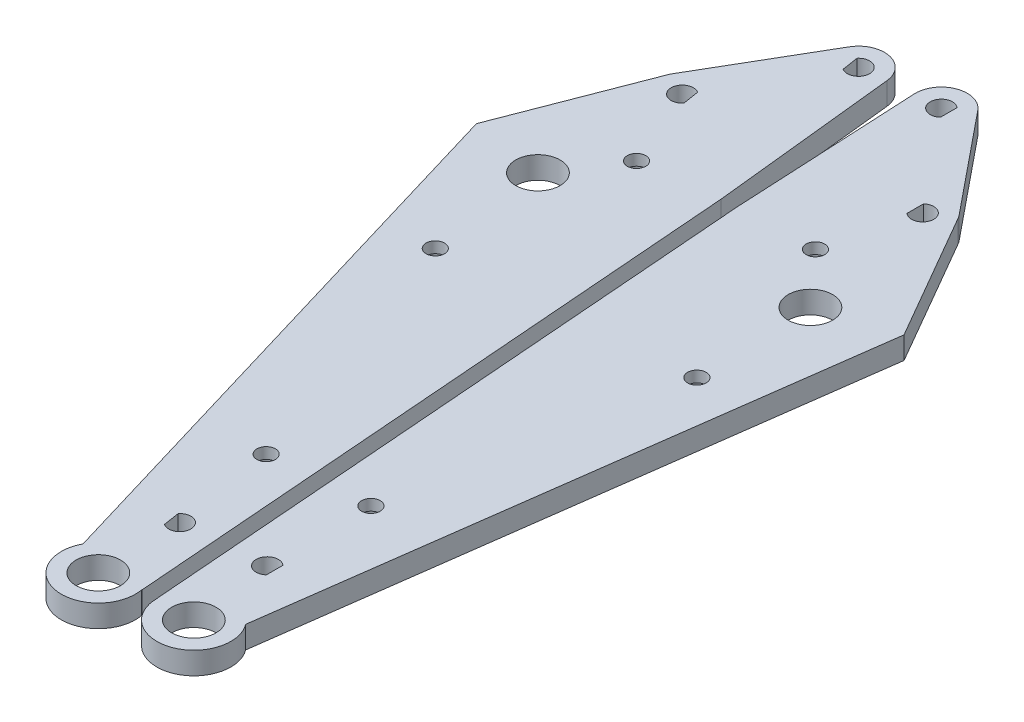
from build123d import *

# Parameters (mm, degrees)
SKETCH_2_R          = 3
EXTRUDE_1_DEPTH     = 3
SKETCH_3_R          = 3.5
EXTRUDE_2_DEPTH     = 3
SKETCH_4_R          = 3.5
EXTRUDE_3_DEPTH     = 3
CUT_EXTRUDE_1_DEPTH = 107.618473768
CUT_EXTRUDE_2_DEPTH = 107.618473768
EXTRUDE_4_DEPTH     = 3
SKETCH_6_R          = 1.25
CUT_EXTRUDE_3_DEPTH = 107.618473768
SKETCH_6_3_R        = 2
SKETCH_6_3_R_2      = 1.25
CUT_EXTRUDE_4_DEPTH = 1.5


with BuildPart() as part:
    # 草图2 → 凸台-拉伸1 (new body)
    with BuildSketch(Plane(origin=(0, 0, 0), x_dir=(1, 0, 0), z_dir=(0, 1, 0))):
        with BuildLine():
            Line((-8, 0), (-15.238247957, -15.382059892))
            Line((-15.238247957, -15.382059892), (-8.643699882, -100.125861646))
            Line((-8.643699882, -100.125861646), (-8.61301011, -100.126871188))
            ThreePointArc((-8.61301011, -100.126871188), (-3.780099648, -105.28855468), (1.381583844, -100.455644218))
            Line((1.381583844, -100.455644218), (1.399355455, -100.456228817))
            Line((1.399355455, -100.456228817), (10.979274058, -19.016660498))
            Line((10.979274058, -19.016660498), (1.010362938, -1.749999943))
            ThreePointArc((1.010362938, -1.749999943), (-0.270725971, -0.46891107), (-2.020725942, 0))
            Line((-2.020725942, 0), (-8, 0))
        make_face()
        with Locations(Location((-3.615713133, -100.291257703, 0), (0, 0, 270))):
            Circle(SKETCH_2_R, mode=Mode.SUBTRACT)
        with BuildLine():
            ThreePointArc((-3.020725942, -2.381966011), (-0.520725942, -3.5), (-3.020725942, -4.618033989))
            Line((-3.020725942, -4.618033989), (-3.020725942, -2.381966011))
        make_face(mode=Mode.SUBTRACT)
        with Locations(Location((1.451061426, -22.124978573, 0), (0, 0, 270))):
            Circle(SKETCH_2_R, mode=Mode.SUBTRACT)
    extrude(amount=EXTRUDE_1_DEPTH)

    # 草图4 → 凸台-拉伸3 (add)
    with BuildSketch(Plane.XZ):
        with Locations((-5, 89)):
            Circle(SKETCH_4_R)
    extrude(amount=-EXTRUDE_3_DEPTH)

    # 草图4<3> → 切除-拉伸1 (cut, through all)
    with BuildSketch(Plane.XZ):
        with BuildLine():
            ThreePointArc((-3.5, 89), (-3.60795306, 89.55875336), (-3.916273757, 90.037081207))
            Line((-3.916273757, 90.037081207), (-4.089754437, 87.807752956))
            ThreePointArc((-4.089754437, 87.807752956), (-3.655498541, 88.334931712), (-3.5, 89))
        make_face()
        with BuildLine():
            Line((-4.089754437, 87.807752956), (-3.916273757, 90.037081207))
            ThreePointArc((-3.916273757, 90.037081207), (-6.495478854, 89.116374378), (-4.089754437, 87.807752956))
        make_face()
    extrude(amount=-CUT_EXTRUDE_1_DEPTH, mode=Mode.SUBTRACT)

    # 草图4<4> → 切除-拉伸2 (cut, through all)
    with BuildSketch(Plane.XZ):
        with BuildLine():
            ThreePointArc((1.384286867, 100.291257703), (1.127703357, 98.710118873), (0.384286867, 97.291257703))
            Line((0.384286867, 97.291257703), (10.979274058, 19.016660498))
            Line((10.979274058, 19.016660498), (1.399355455, 100.456228817))
            Line((1.399355455, 100.456228817), (1.381583844, 100.455644218))
            ThreePointArc((1.381583844, 100.455644218), (1.383611066, 100.373462071), (1.384286867, 100.291257703))
        make_face()
    extrude(amount=-CUT_EXTRUDE_2_DEPTH, mode=Mode.SUBTRACT)



with BuildPart() as body_2:
    # 草图3 → 凸台-拉伸2 (new body)
    with BuildSketch(Plane.XZ):
        with Locations(Location((-13, -10, 0), (0, 0, 270))):
            Circle(SKETCH_3_R)
        with BuildLine():
            Line((-12, -8.881966011), (-12, -11.118033989))
            ThreePointArc((-12, -11.118033989), (-14.5, -10), (-12, -8.881966011))
        make_face(mode=Mode.SUBTRACT)
    extrude(amount=-EXTRUDE_2_DEPTH)


with BuildPart() as part_1:
    add(part.part)

    add(body_2.part)  # 凸台-拉伸4 merges body 2
    # 草图5 → 凸台-拉伸4 (add)
    with BuildSketch(Plane.XZ):
        with BuildLine():
            Line((-10.28463728, -12.208348998), (0.694636778, 1.291651002))
            Line((0.694636778, 1.291651002), (-8, 0))
            Line((-8, 0), (-15.238247957, 15.382059892))
            Line((-15.238247957, 15.382059892), (-16.495653764, -9.825630381))
            ThreePointArc((-16.495653764, -9.825630381), (-11.746385015, -6.732210308), (-10.28463728, -12.208348998))
        make_face()
        with BuildLine():
            Line((-4, 90.118033989), (-4, 87.881966011))
            ThreePointArc((-4, 87.881966011), (-3.5, 89), (-4, 90.118033989))
        make_face()
    extrude(amount=-EXTRUDE_4_DEPTH)

    # 草图6 → 切除-拉伸3 (cut, through all)
    with BuildSketch(Plane.XZ):
        with Locations(Location((-5, 15, 0), (0, 0, 270))):
            Circle(SKETCH_6_R)
        with Locations(Location((2, 38, 0), (0, 0, 270))):
            Circle(SKETCH_6_R)
        with Locations(Location((-5, 75, 0), (0, 0, 270))):
            Circle(SKETCH_6_R)
    extrude(amount=-CUT_EXTRUDE_3_DEPTH, mode=Mode.SUBTRACT)

    # 草图6<3> → 切除-拉伸4 (cut)
    # profile 1 of 3: a face of its own
    with BuildSketch(Plane.XZ):
        with Locations(Location((-5, 15, 0), (0, 0, 270))):
            Circle(SKETCH_6_3_R)
        with Locations(Location((-5, 15, 0), (0, 0, 270))):
            Circle(SKETCH_6_3_R_2, mode=Mode.SUBTRACT)
    # profile 2 of 3: a face of its own
    with BuildSketch(Plane.XZ):
        with Locations(Location((2, 38, 0), (0, 0, 270))):
            Circle(SKETCH_6_3_R)
        with Locations(Location((2, 38, 0), (0, 0, 270))):
            Circle(SKETCH_6_3_R_2, mode=Mode.SUBTRACT)
    # profile 3 of 3: a face of its own
    with BuildSketch(Plane.XZ):
        with Locations(Location((-5, 75, 0), (0, 0, 270))):
            Circle(SKETCH_6_3_R)
        with Locations(Location((-5, 75, 0), (0, 0, 270))):
            Circle(SKETCH_6_3_R_2, mode=Mode.SUBTRACT)
    extrude(amount=-CUT_EXTRUDE_4_DEPTH, mode=Mode.SUBTRACT)


with BuildPart() as body_2_2:
    # 镜向2: mirrored copy
    add(part_1.part.mirror(Plane(origin=(-17.333301301, 0, 1.348833618), x_dir=(0.07758291852835472, 0, 0.9969859029859062), z_dir=(-0.9969859029859062, 0, 0.07758291852835471))))


solid = Compound([part_1.part, body_2_2.part])
